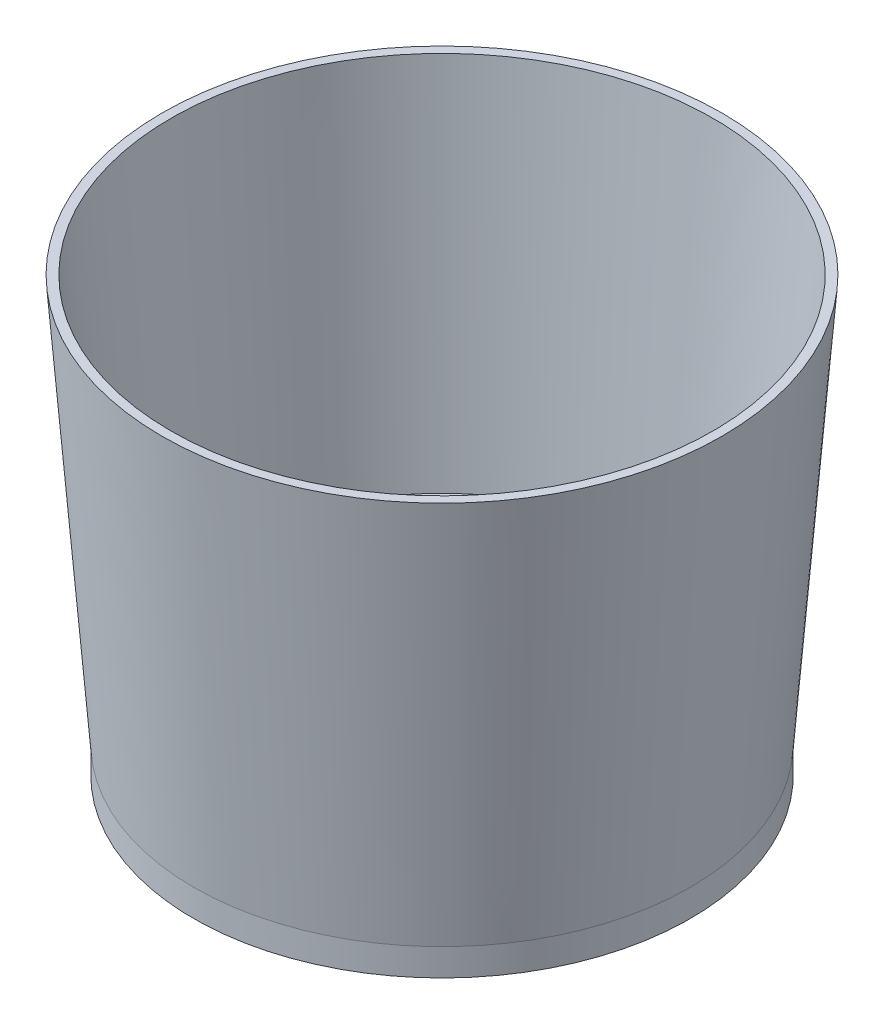
from build123d import *
from build123d.topology import SkipClean

# Parameters (mm, degrees)
SKETCH1_R           = 27.5
SKETCH3_R           = 31
SKETCH3_4_R         = 30
SKETCH1_4_R         = 26.5
SKETCH4_R           = 27.5
SKETCH4_R_2         = 1.5
BOSS_EXTRUDE1_DEPTH = 3
BOSS_EXTRUDE2_START = 6
SKETCH6_R           = 25.5
SKETCH6_R_2         = 1.5
BOSS_EXTRUDE2_DEPTH = 6
SKETCH7_R           = 3.5
CUT_EXTRUDE1_DEPTH  = 3


with BuildPart() as part:
    # Sketch1 → Loft1 section 0
    with BuildSketch(Plane(origin=(0, 0, 0), x_dir=(1, 0, 0), z_dir=(0, 1, 0))):
        Circle(SKETCH1_R)
    # Sketch3 → Loft1 section 1
    with BuildSketch(Plane(origin=(0, 45, 0), x_dir=(1, 0, 0), z_dir=(0, 1, 0))):
        Circle(SKETCH3_R)
    loft()

    # Sketch3<4> → Cut-Loft1 section 0
    with BuildSketch(Plane(origin=(0, 45, 0), x_dir=(1, 0, 0), z_dir=(0, 1, 0))):
        Circle(SKETCH3_4_R)
    # Sketch1<4> → Cut-Loft1 section 1
    with BuildSketch(Plane(origin=(0, 0, 0), x_dir=(1, 0, 0), z_dir=(0, 1, 0))):
        Circle(SKETCH1_4_R)
    loft(mode=Mode.SUBTRACT)

    # Sketch4 → Boss-Extrude1 (add)
    with BuildSketch(Plane.XZ):
        with Locations(Location((0, 0, 0), (0, 0, 270))):
            Circle(SKETCH4_R)
        with Locations(Location((0, 15, 0), (0, 0, 270))):
            Circle(SKETCH4_R_2, mode=Mode.SUBTRACT)
        with Locations(Location((15, 0, 0), (0, 0, 270))):
            Circle(SKETCH4_R_2, mode=Mode.SUBTRACT)
        with Locations(Location((0, -15, 0), (0, 0, 270))):
            Circle(SKETCH4_R_2, mode=Mode.SUBTRACT)
        with Locations(Location((-15, 0, 0), (0, 0, 270))):
            Circle(SKETCH4_R_2, mode=Mode.SUBTRACT)
    extrude(amount=BOSS_EXTRUDE1_DEPTH)

    # Sketch6 → Boss-Extrude2 (add)
    with SkipClean():  # the faces are left unmerged after this step: merging them gives an invalid solid
        with BuildSketch(Plane(origin=(0, 0, 0), x_dir=(1, 0, 0), z_dir=(0, 1, 0)).offset(BOSS_EXTRUDE2_START)):
            with Locations(Location((0, 0, 0), (0, 0, 90))):
                Circle(SKETCH6_R)
            with Locations(Location((0, 15, 0), (0, 0, 270))):
                Circle(SKETCH6_R_2, mode=Mode.SUBTRACT)
            with Locations(Location((15, 0, 0), (0, 0, 270))):
                Circle(SKETCH6_R_2, mode=Mode.SUBTRACT)
            with Locations(Location((0, -15, 0), (0, 0, 270))):
                Circle(SKETCH6_R_2, mode=Mode.SUBTRACT)
            with Locations(Location((-15, 0, 0), (0, 0, 270))):
                Circle(SKETCH6_R_2, mode=Mode.SUBTRACT)
        extrude(amount=-BOSS_EXTRUDE2_DEPTH)

    # Sketch7 → Cut-Extrude1 (cut)
    with SkipClean():  # the faces are left unmerged after this step: merging them gives an invalid solid
        with BuildSketch(Plane(origin=(0, 6, 0), x_dir=(1, 0, 0), z_dir=(0, 1, 0))):
            with Locations(Location((0, 15, 0), (0, 0, 270))):
                Circle(SKETCH7_R)
            with Locations(Location((15, 0, 0), (0, 0, 270))):
                Circle(SKETCH7_R)
            with Locations(Location((0, -15, 0), (0, 0, 270))):
                Circle(SKETCH7_R)
            with Locations(Location((-15, 0, 0), (0, 0, 270))):
                Circle(SKETCH7_R)
        extrude(amount=-CUT_EXTRUDE1_DEPTH, mode=Mode.SUBTRACT)


solid = part.part
